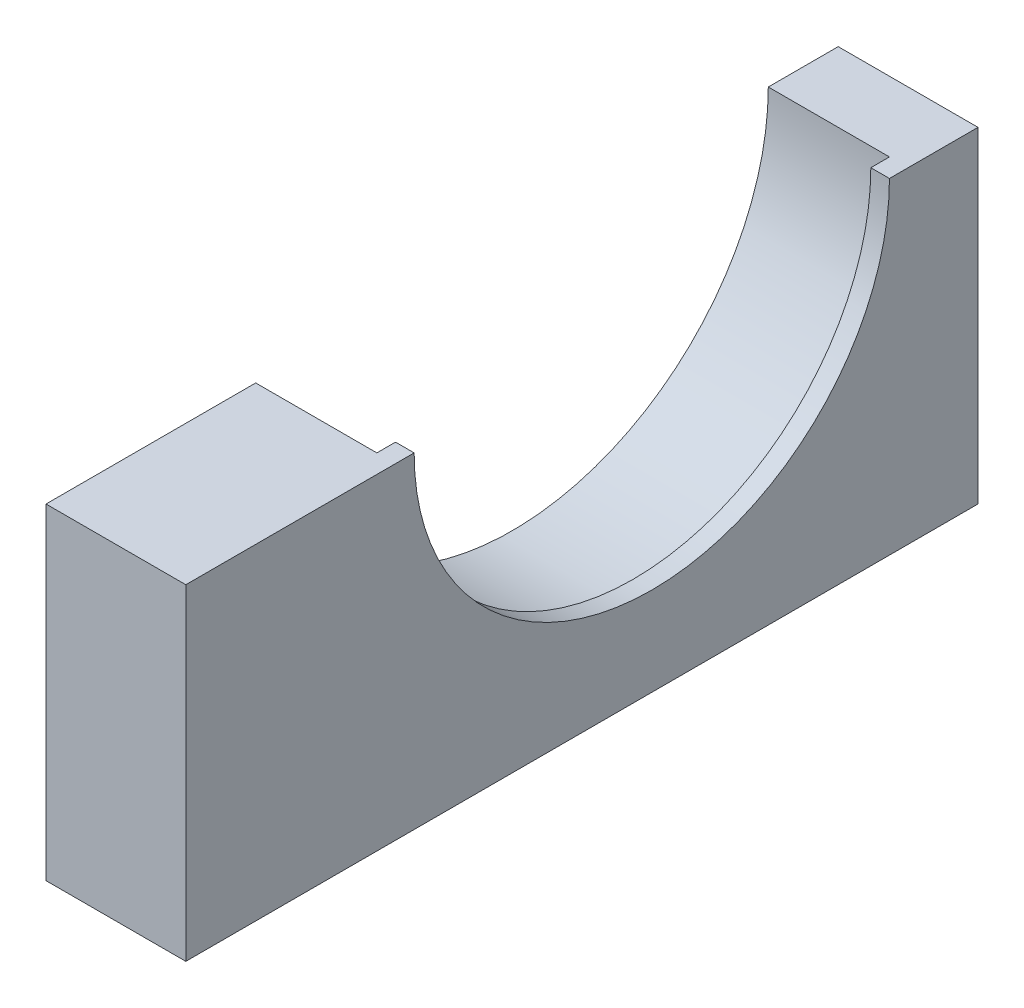
from build123d import *

# Parameters (mm, degrees)
BOSS_EXTRUDE1_DEPTH = 13
BOSS_EXTRUDE4_DEPTH = 2


with BuildPart() as part:
    # Sketch1 → Boss-Extrude1 (new body)
    with BuildSketch(Plane(origin=(0, 0, 0), x_dir=(0, 0, -1), z_dir=(1, 0, 0))):
        with BuildLine():
            Line((-50, 0), (-27.5, 0))
            ThreePointArc((-27.5, 0), (0, -27.5), (27.5, 0))
            Line((27.5, 0), (35, 0))
            Line((35, 0), (35, -35))
            Line((35, -35), (-50, -35))
            Line((-50, -35), (-50, 0))
        make_face()
    extrude(amount=BOSS_EXTRUDE1_DEPTH)

    # Sketch4 → Boss-Extrude4 (add)
    with BuildSketch(Plane(origin=(13, 0, 0), x_dir=(0, 0, -1), z_dir=(1, 0, 0))):
        with BuildLine():
            Line((35, 0), (35, -35))
            Line((35, -35), (-50, -35))
            Line((-50, -35), (-50, 0))
            Line((-50, 0), (-25.5, 0))
            ThreePointArc((-25.5, 0), (0, -25.5), (25.5, 0))
            Line((25.5, 0), (35, 0))
        make_face()
    extrude(amount=BOSS_EXTRUDE4_DEPTH)


solid = part.part
